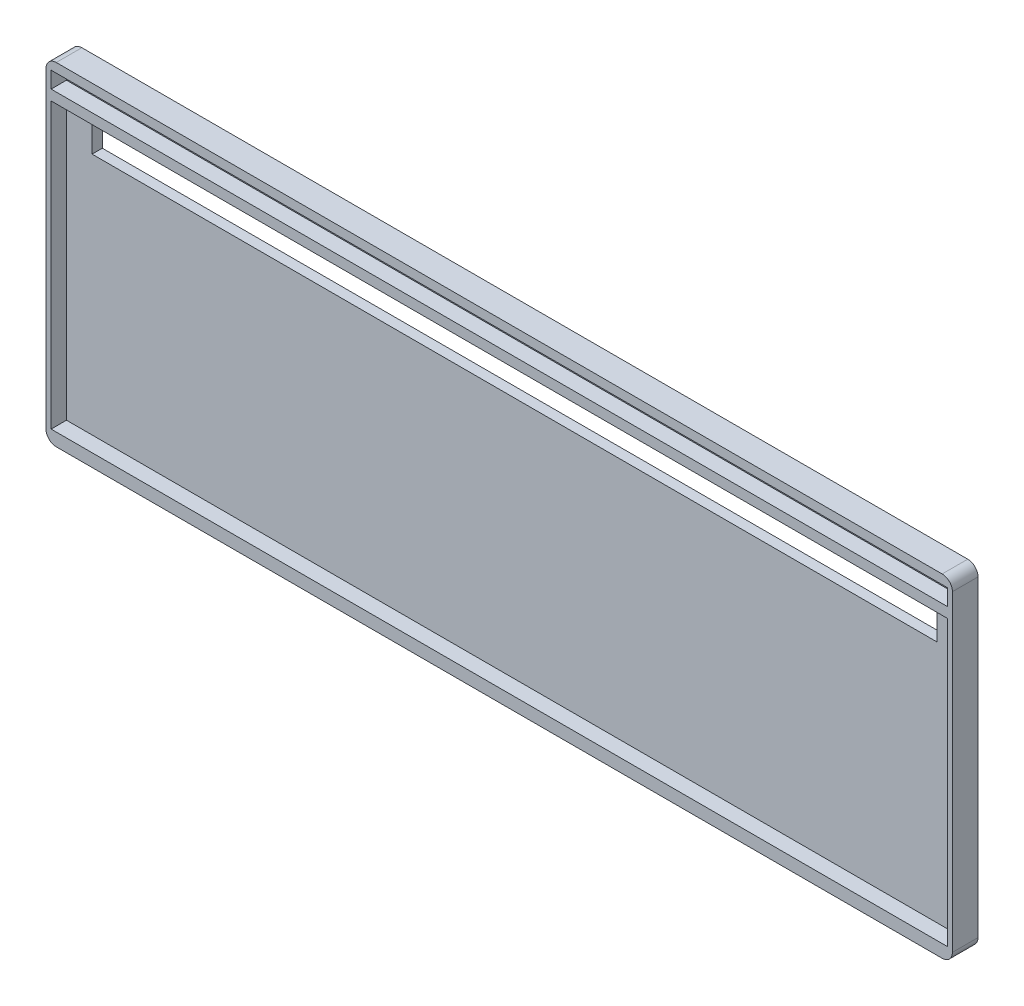
from build123d import *

# Parameters (mm, degrees)
SKETCH_1_W          = 177
SKETCH_1_H          = 65
EXTRUDE_1_DEPTH     = 5
SKETCH_2_W          = 175
SKETCH_2_H          = 2.5
SKETCH_2_H_2        = 55.5
SKETCH_2_H_3        = 0.7
CUT_EXTRUDE_1_DEPTH = 3
FILLET_1_R          = 2
SKETCH_4_W          = 165
SKETCH_4_H          = 6
CUT_EXTRUDE_2_DEPTH = 3


with BuildPart() as part:
    # 草图1 → 凸台-拉伸1 (new body)
    with BuildSketch(Plane.XY):
        Rectangle(SKETCH_1_W, SKETCH_1_H)
    extrude(amount=EXTRUDE_1_DEPTH)

    # 草图2 → 切除-拉伸1 (cut)
    with BuildSketch(Plane.XY.offset(5)):
        with Locations((0, 28.75)):
            Rectangle(SKETCH_2_W, SKETCH_2_H)
        with Locations((0, -2.25)):
            Rectangle(SKETCH_2_W, SKETCH_2_H_2)
        with Locations((0, 30.35)):
            Rectangle(SKETCH_2_W, SKETCH_2_H_3)
    extrude(amount=-CUT_EXTRUDE_1_DEPTH, mode=Mode.SUBTRACT)

    # 圆角1
    fillet_1_edges = [part.edges().sort_by_distance(p)[0] for p in [
        (88.5, -32.5, 2.5),
        (-88.5, -32.5, 2.5),
        (-88.5, 32.5, 2.5),
        (88.5, 32.5, 2.5),
    ]]
    fillet(fillet_1_edges, radius=FILLET_1_R)

    # 草图4 → 切除-拉伸2 (cut)
    with BuildSketch(Plane.XY.offset(2)):
        with Locations((0, 20.5)):
            Rectangle(SKETCH_4_W, SKETCH_4_H)
    extrude(amount=-CUT_EXTRUDE_2_DEPTH, mode=Mode.SUBTRACT)


solid = part.part
